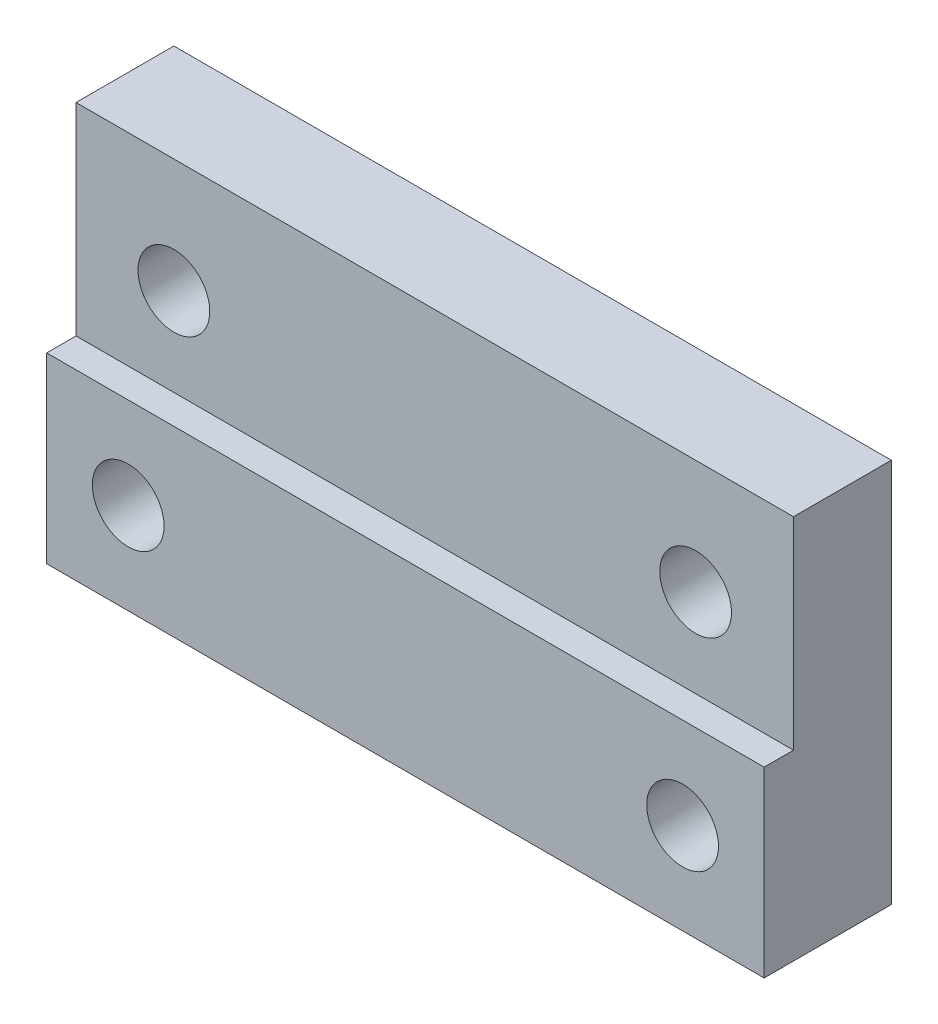
from build123d import *

# Parameters (mm, degrees)
SKETCH1_W           = 22
SKETCH1_H           = 3
BOSS_EXTRUDE1_DEPTH = 11.8
SKETCH1_3_W         = 22
SKETCH1_3_H         = 0.9
BOSS_EXTRUDE2_DEPTH = 5.6
CUT_EXTRUDE1_REACH  = 18.597
SKETCH2_R           = 1.1


with BuildPart() as part:
    # Sketch1 → Boss-Extrude1 (new body)
    with BuildSketch(Plane(origin=(0, 0, 0), x_dir=(1, 0, 0), z_dir=(0, 1, 0))):
        with Locations((0, 0.45)):
            Rectangle(SKETCH1_W, SKETCH1_H)
    extrude(amount=BOSS_EXTRUDE1_DEPTH)

    # Sketch1<3> → Boss-Extrude2 (add)
    with BuildSketch(Plane(origin=(0, 0, 0), x_dir=(1, 0, 0), z_dir=(0, 1, 0))):
        with Locations((0, -1.5)):
            Rectangle(SKETCH1_3_W, SKETCH1_3_H)
    extrude(amount=BOSS_EXTRUDE2_DEPTH)

    # Cut-Extrude1: up to this face of the body (flat: up to its plane)
    cut_extrude1_end = Plane(part.part.faces().sort_by_distance((0, 2.8, 1.95))[0])
    # Sketch2 → Cut-Extrude1 (cut, up to the picked face)
    with BuildSketch(Plane(origin=(0, 0, -1.95), x_dir=(-1, 0, 0), z_dir=(0, 0, -1)), mode=Mode.PRIVATE) as cut_extrude1_sk1:
        with Locations((-8.5, 2.8)):
            Circle(SKETCH2_R)
    cut_extrude1_tool1 = split(extrude(cut_extrude1_sk1.sketch, amount=-CUT_EXTRUDE1_REACH, mode=Mode.PRIVATE), bisect_by=cut_extrude1_end, keep=Keep.BOTH, mode=Mode.PRIVATE)
    # Sketch2 → Cut-Extrude1 (cut, up to the picked face)
    with BuildSketch(Plane(origin=(0, 0, -1.95), x_dir=(-1, 0, 0), z_dir=(0, 0, -1)), mode=Mode.PRIVATE) as cut_extrude1_sk2:
        with Locations((-8, 8.3)):
            Circle(SKETCH2_R)
    cut_extrude1_tool2 = split(extrude(cut_extrude1_sk2.sketch, amount=-CUT_EXTRUDE1_REACH, mode=Mode.PRIVATE), bisect_by=cut_extrude1_end, keep=Keep.BOTH, mode=Mode.PRIVATE)
    cut_extrude1_1 = cut_extrude1_tool1.solids().sort_by(Axis((8.5, 2.8, -1.95), (0, 0, 1)))[0]
    add(cut_extrude1_1, mode=Mode.SUBTRACT)
    cut_extrude1_2 = cut_extrude1_tool2.solids().sort_by(Axis((8, 8.3, -1.95), (0, 0, 1)))[0]
    add(cut_extrude1_2, mode=Mode.SUBTRACT)
    cut_extrude1 = cut_extrude1_1 + cut_extrude1_2  # Cut-Extrude1 as one shape, for the pattern or mirror that repeats it

    # Mirror1: Cut-Extrude1 across plane
    add(cut_extrude1.mirror(Plane(origin=(0, 0, 0), x_dir=(0, 0, 1), z_dir=(1, 0, 0))), mode=Mode.SUBTRACT)


solid = part.part
